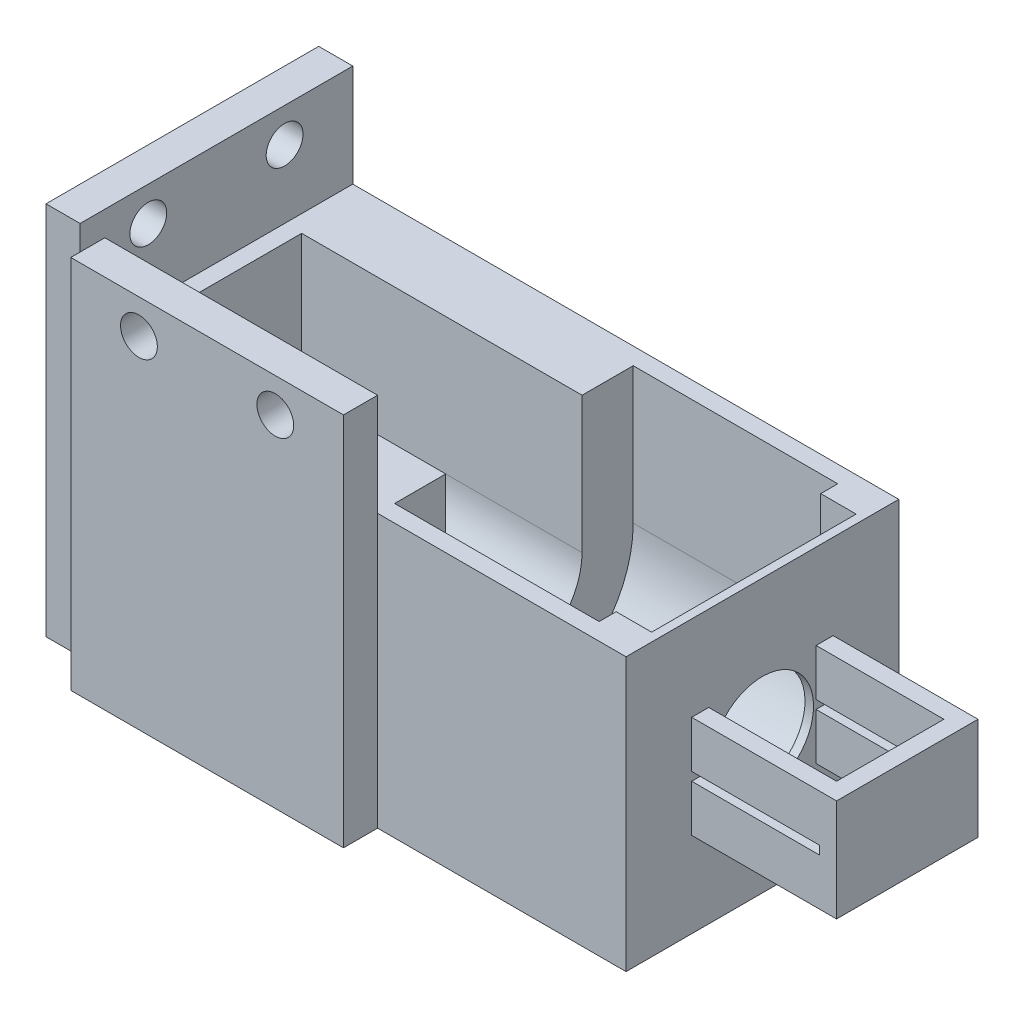
from build123d import *

# Parameters (mm, degrees)
SKETCH1_W                = 116.84
SKETCH1_H                = 50.8
BOSS_EXTRUDE1_DEPTH      = 25.4
SKETCH38_W               = 20
SKETCH38_H               = 20
CUT_EXTRUDE33_DEPTH      = 23.8125
SKETCH37_W               = 50.8
SKETCH37_H               = 25.4
CUT_EXTRUDE32_DEPTH      = 130.912992422
BOSS_EXTRUDE5_DEPTH      = 25.4
CUT_EXTRUDE54_DEPTH      = 96.038097624
CUT_EXTRUDE54_DEPTH_BACK = 96.038097624
SKETCH45_W               = 43.7094
SKETCH45_H               = 19.05
SKETCH53_R               = 2
CUT_EXTRUDE46_DEPTH      = 0.0254
CUT_EXTRUDE55_DEPTH      = 87.36933773
SKETCH61_R               = 9.906
SKETCH61_R_2             = 9.525
BOSS_EXTRUDE11_DEPTH     = 1.5875
BOSS_EXTRUDE17_REACH     = 97.038
SKETCH70_W               = 1.5875
SKETCH70_H               = 19.812
SKETCH76_W               = 23.8125
SKETCH76_H               = 20
CUT_EXTRUDE58_DEPTH      = 88.776762301
CUT_EXTRUDE59_DEPTH      = 96.038097624
CUT_EXTRUDE59_DEPTH_BACK = 96.038097624
SKETCH77_W               = 23.8125
SKETCH77_H               = 1.5875
BOSS_EXTRUDE24_DEPTH     = 3.175
BOSS_EXTRUDE18_START     = 25.4
BOSS_EXTRUDE18_DEPTH     = 25.4
SKETCH79_W               = 50.8
SKETCH79_H               = 50.8
BOSS_EXTRUDE19_DEPTH     = 3.175
SKETCH80_W               = 50.8
SKETCH80_H               = 101.6
BOSS_EXTRUDE20_DEPTH     = 6.35
SKETCH81_R               = 3.429
CUT_EXTRUDE60_DEPTH      = 141.668809576
SKETCH82_W               = 50.8
SKETCH82_H               = 101.6
BOSS_EXTRUDE21_DEPTH     = 6.35
SKETCH83_R               = 3.429
CUT_EXTRUDE61_DEPTH      = 133.325529
SKETCH84_W               = 110.249820412
SKETCH84_H               = 109.628139174
CUT_EXTRUDE62_DEPTH      = 31.75
SKETCH87_W               = 26.9875
SKETCH87_H               = 38.575
CUT_EXTRUDE63_DEPTH      = 15.875
SKETCH89_W               = 19.639231936
SKETCH89_H               = 5.196150416
CUT_EXTRUDE64_DEPTH      = 127.243685486


with BuildPart() as part:
    # Sketch1 → Boss-Extrude1 (new, symmetric)
    with BuildSketch(Plane.XY):
        with Locations((-17.78, -25.4)):
            Rectangle(SKETCH1_W, SKETCH1_H)
    extrude(amount=BOSS_EXTRUDE1_DEPTH, both=True)

    # Sketch2 → Cut-Revolve1 (revolve, cut)
    with BuildSketch(Plane.XY, mode=Mode.PRIVATE) as cut_revolve1_sk:
        Polygon((-49.3609, -3.175), (-49.3609, -12.7), (-220.202391615, -12.7), (-220.202391615, -25.4), (-157.809194346, -25.4), (-128.417210056, -25.4), (19.629439755, -25.4), (20.7431, -25.4), (20.7431, -15.494), (-4.6569, -15.494), (-4.6569, -6.35), (-11.2609, -6.35), (-11.2609, -3.175), align=None)
    revolve(cut_revolve1_sk.sketch.rotate(Axis((-152.482877195, -25.4, 0), (1, 0, 0)), 90), axis=Axis((-152.482877195, -25.4, 0), (1, 0, 0)), mode=Mode.SUBTRACT)

    # Sketch38 → Cut-Extrude33 (cut)
    with BuildSketch(Plane(origin=(20.7431, 0, 0), x_dir=(0, 0, -1), z_dir=(1, 0, 0))):
        with Locations((0, -25.4)):
            Rectangle(SKETCH38_W, SKETCH38_H)
    extrude(amount=-CUT_EXTRUDE33_DEPTH, mode=Mode.SUBTRACT)

    # Sketch37 → Cut-Extrude32 (cut, through all)
    with BuildSketch(Plane(origin=(40.64, 0, 0), x_dir=(0, 0, -1), z_dir=(1, 0, 0))):
        with Locations((0, -12.7)):
            Rectangle(SKETCH37_W, SKETCH37_H)
    extrude(amount=-CUT_EXTRUDE32_DEPTH, mode=Mode.SUBTRACT)

    # Sketch39 → Boss-Extrude5 (add)
    with BuildSketch(Plane(origin=(0, -25.4, 0), x_dir=(1, 0, 0), z_dir=(0, 1, 0))):
        Polygon((-3.0694, 9.906), (-3.0694, 10), (20.7431, 10), (20.7431, -10), (-3.0694, -10), (-3.0694, -9.906), (-4.6569, -9.906), (-4.6569, -19.05), (-11.2609, -19.05), (-11.2609, -22.225), (-49.3609, -22.225), (-49.3609, -12.7), (-76.2, -12.7), (-76.2, -25.4), (40.64, -25.4), (40.64, 25.4), (-76.2, 25.4), (-76.2, 12.7), (-49.3609, 12.7), (-49.3609, 22.225), (-11.2609, 22.225), (-11.2609, 19.05), (-4.6569, 19.05), (-4.6569, 9.906), align=None)
    extrude(amount=BOSS_EXTRUDE5_DEPTH)

    # Sketch45 → Cut-Extrude54 (cut, two sides: drawn at the far end of the back side and taken through both)
    with BuildSketch(Plane.XY.offset(-CUT_EXTRUDE54_DEPTH_BACK)):
        with Locations((18.7853, -9.525)):
            Rectangle(SKETCH45_W, SKETCH45_H)
    extrude(amount=CUT_EXTRUDE54_DEPTH + CUT_EXTRUDE54_DEPTH_BACK, mode=Mode.SUBTRACT)

    # Sketch53 → Cut-Extrude46 (cut)
    with BuildSketch(Plane.ZY.offset(-20.7431)):
        with Locations((0, -25.4)):
            Circle(SKETCH53_R)
    extrude(amount=-CUT_EXTRUDE46_DEPTH, mode=Mode.SUBTRACT)

    # Sketch72 → Cut-Extrude55 (cut, through all)
    with BuildSketch(Plane(origin=(0, -19.05, 0), x_dir=(1, 0, 0), z_dir=(0, 1, 0))):
        Polygon((-3.0694, -25.4), (-3.0694, -13.175), (23.9181, -13.175), (23.9181, 13.175), (-3.0694, 13.175), (-3.0694, 25.4), (40.64, 25.4), (40.64, -25.4), align=None)
    extrude(amount=-CUT_EXTRUDE55_DEPTH, mode=Mode.SUBTRACT)

    # Sketch61 → Boss-Extrude11 (add)
    with BuildSketch(Plane.ZY.offset(4.6569)):
        with Locations((0, -25.4)):
            Circle(SKETCH61_R)
        with Locations(Location((0, -25.4, 0), (0, 0, 270))):
            Circle(SKETCH61_R_2, mode=Mode.SUBTRACT)
    extrude(amount=-BOSS_EXTRUDE11_DEPTH)

    # Sketch70 → Boss-Extrude17 (add, up to next)
    with BuildSketch(Plane(origin=(0, 0, 0), x_dir=(1, 0, 0), z_dir=(0, 1, 0)), mode=Mode.PRIVATE) as boss_extrude17_sk1:
        with Locations((-3.86315, 0)):
            Rectangle(SKETCH70_W, SKETCH70_H)
    boss_extrude17_tool1 = extrude(boss_extrude17_sk1.sketch, amount=-BOSS_EXTRUDE17_REACH, mode=Mode.PRIVATE) - part.part
    add(boss_extrude17_tool1.solids().sort_by_distance((-3.86315, 0, 0))[0])

    # Sketch76 → Cut-Extrude58 (cut, through all)
    with BuildSketch(Plane(origin=(0, -35.4, 0), x_dir=(1, 0, 0), z_dir=(0, 1, 0))):
        with Locations((8.83685, 0)):
            Rectangle(SKETCH76_W, SKETCH76_H)
    extrude(amount=-CUT_EXTRUDE58_DEPTH, mode=Mode.SUBTRACT)

    # Sketch77 → Cut-Extrude59 (cut, two sides: drawn at the far end of the back side and taken through both)
    with BuildSketch(Plane.XY.offset(-CUT_EXTRUDE59_DEPTH_BACK)):
        with Locations((8.83685, -25.4)):
            Rectangle(SKETCH77_W, SKETCH77_H)
    extrude(amount=CUT_EXTRUDE59_DEPTH + CUT_EXTRUDE59_DEPTH_BACK, mode=Mode.SUBTRACT)

    # Sketch86 → Boss-Extrude24 (add)
    with BuildSketch(Plane(origin=(0, -19.05, 0), x_dir=(1, 0, 0), z_dir=(0, 1, 0))):
        Polygon((20.7431, 10), (20.7431, -10), (-3.0694, -10), (-3.0694, -13.175), (23.9181, -13.175), (23.9181, 13.175), (-3.0694, 13.175), (-3.0694, 10), align=None)
    extrude(amount=BOSS_EXTRUDE24_DEPTH)

    # Sketch78 → Boss-Extrude18 (add)
    with BuildSketch(Plane.ZY.offset(76.2).offset(BOSS_EXTRUDE18_START)):
        with BuildLine():
            Line((25.4, -50.8), (25.4, 0))
            Line((25.4, 0), (12.7, 0))
            Line((12.7, 0), (12.7, -25.4))
            ThreePointArc((12.7, -25.4), (0, -38.1), (-12.7, -25.4))
            Line((-12.7, -25.4), (-12.7, 0))
            Line((-12.7, 0), (-25.4, 0))
            Line((-25.4, 0), (-25.4, -50.8))
            Line((-25.4, -50.8), (25.4, -50.8))
        make_face()
    extrude(amount=-BOSS_EXTRUDE18_DEPTH)

    # Sketch79 → Boss-Extrude19 (add)
    with BuildSketch(Plane.ZY.offset(101.6)):
        with Locations((0, -25.4)):
            Rectangle(SKETCH79_W, SKETCH79_H)
    extrude(amount=BOSS_EXTRUDE19_DEPTH)

    # Sketch80 → Boss-Extrude20 (add)
    with BuildSketch(Plane.ZY.offset(104.775)):
        Rectangle(SKETCH80_W, SKETCH80_H)
    extrude(amount=BOSS_EXTRUDE20_DEPTH)

    # Sketch81 → Cut-Extrude60 (cut, through all)
    with BuildSketch(Plane(origin=(-104.775, 0, 0), x_dir=(0, 0, -1), z_dir=(1, 0, 0))):
        with Locations((-12.7, 38.1)):
            Circle(SKETCH81_R)
        with Locations((12.7, 38.1)):
            Circle(SKETCH81_R)
        with Locations((12.7, 12.7)):
            Circle(SKETCH81_R)
        with Locations((-12.7, 12.7)):
            Circle(SKETCH81_R)
    extrude(amount=-CUT_EXTRUDE60_DEPTH, mode=Mode.SUBTRACT)

    # Sketch82 → Boss-Extrude21 (add)
    with BuildSketch(Plane.XY.offset(25.4)):
        with Locations((-74.7609, 0)):
            Rectangle(SKETCH82_W, SKETCH82_H)
    extrude(amount=BOSS_EXTRUDE21_DEPTH)

    # Sketch83 → Cut-Extrude61 (cut, through all)
    with BuildSketch(Plane(origin=(0, 0, 25.4), x_dir=(-1, 0, 0), z_dir=(0, 0, -1))):
        with Locations((62.0609, 38.1)):
            Circle(SKETCH83_R)
        with Locations((87.4609, 38.1)):
            Circle(SKETCH83_R)
        with Locations((87.4609, 12.7)):
            Circle(SKETCH83_R)
        with Locations((62.0609, 12.7)):
            Circle(SKETCH83_R)
    extrude(amount=-CUT_EXTRUDE61_DEPTH, mode=Mode.SUBTRACT)

    # Sketch84 → Cut-Extrude62 (cut)
    with BuildSketch(Plane(origin=(0, 50.8, 0), x_dir=(1, 0, 0), z_dir=(0, 1, 0))):
        with Locations((-74.595326767, 1.567462675)):
            Rectangle(SKETCH84_W, SKETCH84_H)
    extrude(amount=-CUT_EXTRUDE62_DEPTH, mode=Mode.SUBTRACT)

    # Sketch87 → Cut-Extrude63 (cut)
    with BuildSketch(Plane.XZ.offset(50.8)):
        with Locations((10.42435, -6.1125)):
            Rectangle(SKETCH87_W, SKETCH87_H)
    extrude(amount=-CUT_EXTRUDE63_DEPTH, mode=Mode.SUBTRACT)

    # Sketch89 → Cut-Extrude64 (cut, through all)
    with BuildSketch(Plane(origin=(0, 0, 0), x_dir=(1, 0, 0), z_dir=(0, 1, 0))):
        with Locations((-28.540888117, 0)):
            Rectangle(SKETCH89_W, SKETCH89_H)
        with Locations((-74.75534535, 0)):
            Rectangle(SKETCH89_W, SKETCH89_H)
    extrude(amount=-CUT_EXTRUDE64_DEPTH, mode=Mode.SUBTRACT)


solid = part.part
